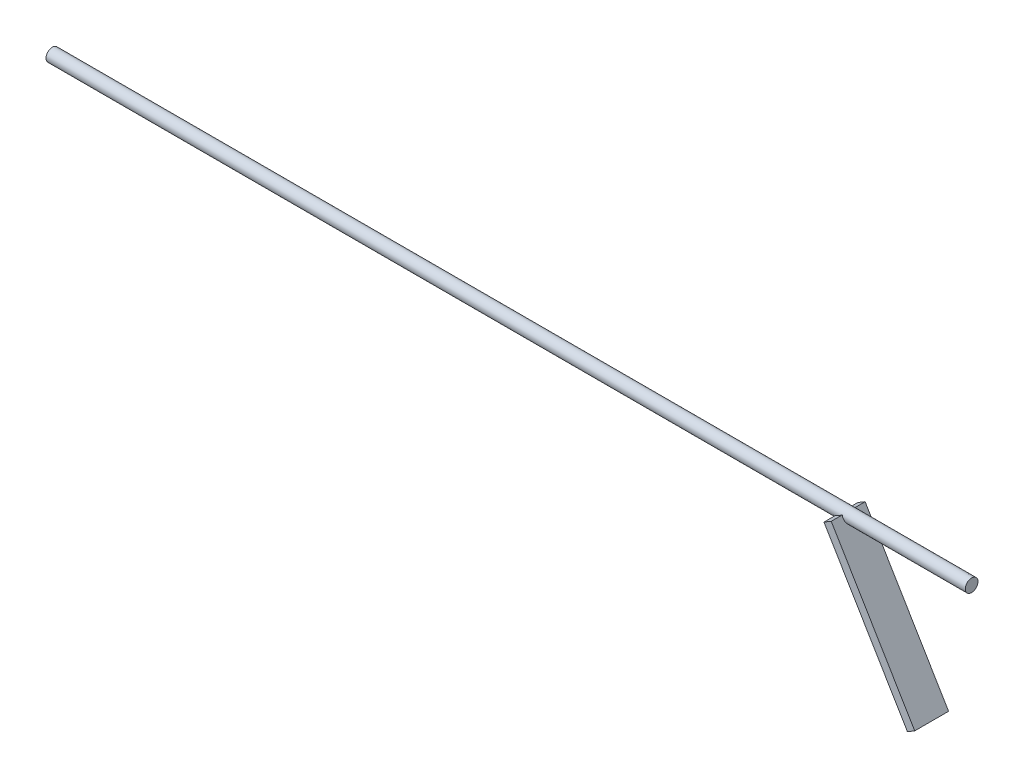
from build123d import *

# Parameters (mm, degrees)
BOSS_EXTRUDE1_START = -197
SKETCH1_R           = 1.5
BOSS_EXTRUDE1_DEPTH = 217
BOSS_EXTRUDE2_START = -4
BOSS_EXTRUDE2_DEPTH = 8


with BuildPart() as part:
    # Sketch1 → Boss-Extrude1 (new body)
    with BuildSketch(Plane(origin=(0, 0, 0), x_dir=(0, 0, -1), z_dir=(1, 0, 0)).offset(BOSS_EXTRUDE1_START)):
        Circle(SKETCH1_R)
    extrude(amount=BOSS_EXTRUDE1_DEPTH)

    # Sketch2 → Boss-Extrude2 (add)
    with BuildSketch(Plane.XY.offset(BOSS_EXTRUDE2_START)):
        Polygon((-10.858638704, -0.512581287), (-9.141361296, 0.512581287), (10.558638704, -32.487418713), (8.841361296, -33.512581287), align=None)
    extrude(amount=BOSS_EXTRUDE2_DEPTH)


solid = part.part
